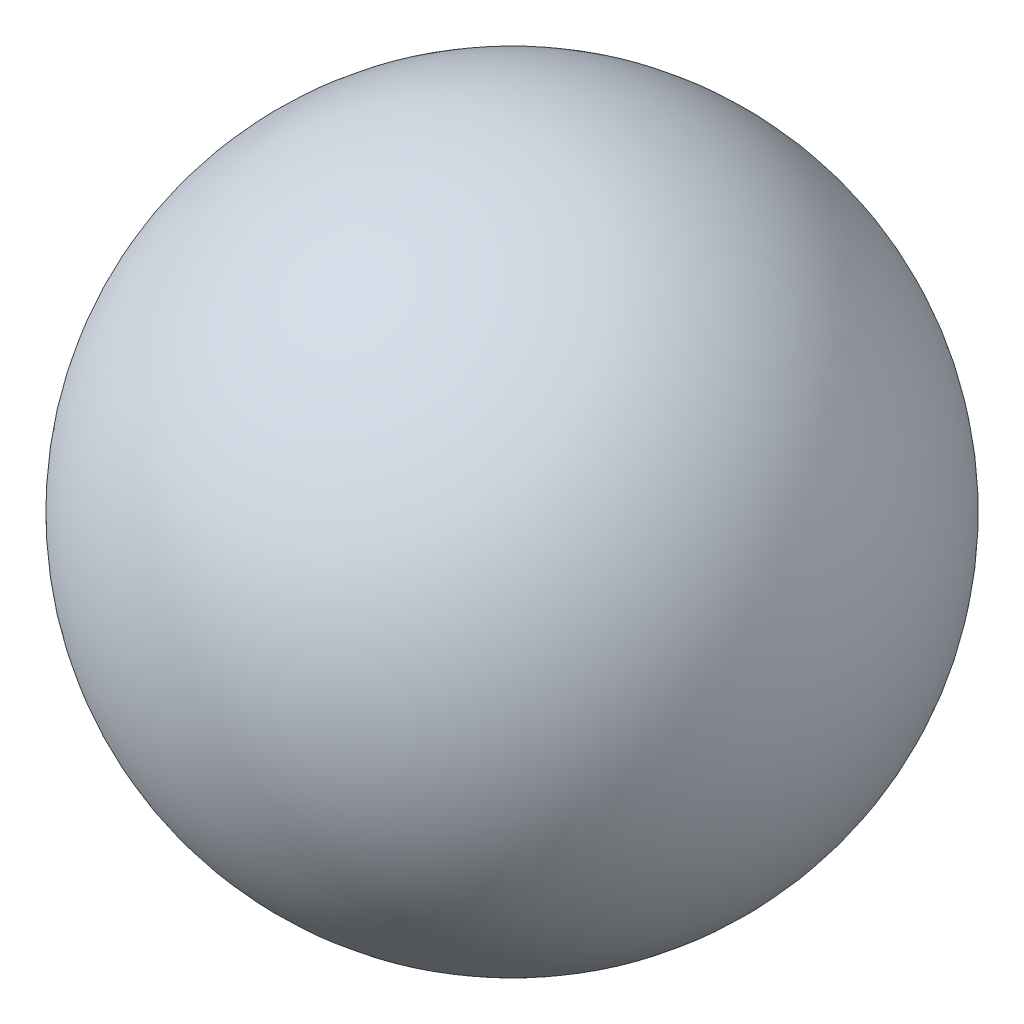
from build123d import *


with BuildPart() as part:
    # Sketch1 → Revolve1 (revolve)
    with BuildSketch(Plane.XY):
        with BuildLine():
            Line((0, 951.416921044), (0, 943.416921044))
            ThreePointArc((0, 943.416921044), (4, 947.416921044), (0, 951.416921044))
        make_face()
    revolve(axis=Axis((0, 951.416921044, 0), (0, -1, 0)))


solid = part.part
